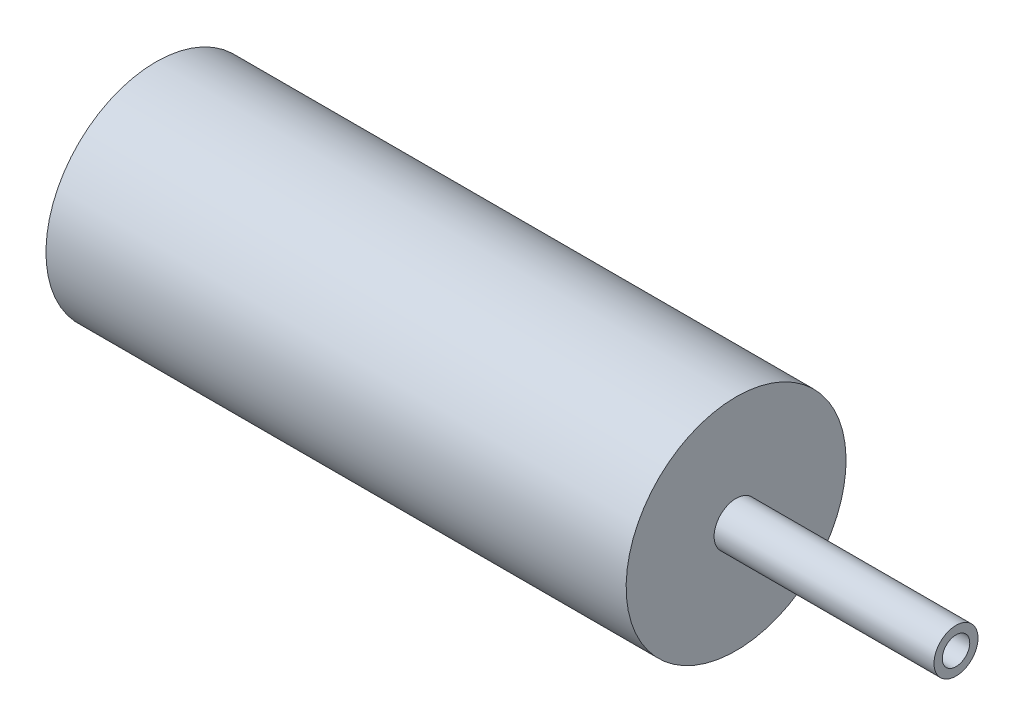
from build123d import *
from build123d.topology import SkipClean

# Parameters (mm, degrees)
CUT_EXTRUDE1_START  = -0.5
CUT_EXTRUDE1_DEPTH  = 2
CIRPATTERN1_COUNT   = 8
SKETCH3_R           = 0.75
SKETCH3_R_2         = 0.625
BOSS_EXTRUDE1_DEPTH = 2.5
CUT_EXTRUDE2_START  = -2.5
SKETCH4_R           = 0.625
CUT_EXTRUDE2_DEPTH  = 2.5
BOSS_EXTRUDE2_START = 10
SKETCH5_R           = 1
SKETCH5_R_2         = 0.625
BOSS_EXTRUDE2_DEPTH = 10


with BuildPart() as part:
    # Sketch1 → Revolve1 (revolve)
    with BuildSketch(Plane.XY):
        Polygon((0, 0), (0, 1), (-1, 2), (-7, 2), (-7, 4), (-10, 4), (-10, 3), (-13, 3), (-14.5, 4.5), (-24.88, 4.5), (-24.88, 5), (1.5, 5), (1.5, 0), align=None)
    revolve(axis=Axis((1.5, 0, 0), (-1, 0, 0)))

    # Sketch2 → Cut-Extrude1 (cut)
    with BuildSketch(Plane.ZY.offset(7).offset(CUT_EXTRUDE1_START)):
        with BuildLine():
            Line((-2, -0.1), (-3.9, -0.1))
            ThreePointArc((-3.9, -0.1), (-4, 0), (-3.9, 0.1))
            Line((-3.9, 0.1), (-2, 0.1))
            ThreePointArc((-2, 0.1), (-1.9, 0), (-2, -0.1))
        make_face()
    cut_extrude1 = extrude(amount=CUT_EXTRUDE1_DEPTH, mode=Mode.SUBTRACT)

    # CirPattern1: Cut-Extrude1 ×8 about axis
    cirpattern1_axis = Axis((0, 0, 0), (1, 0, 0))
    for i in range(1, CIRPATTERN1_COUNT):
        add(cut_extrude1.rotate(cirpattern1_axis, i * 360 / CIRPATTERN1_COUNT), mode=Mode.SUBTRACT)

    # Sketch3 → Boss-Extrude1 (add)
    with BuildSketch(Plane.ZY):
        with Locations(Location((0, 0, 0), (0, 0, 270))):
            Circle(SKETCH3_R)
        with Locations(Location((0, 0, 0), (0, 0, 270))):
            Circle(SKETCH3_R_2, mode=Mode.SUBTRACT)
    extrude(amount=BOSS_EXTRUDE1_DEPTH)

    # Sketch4 → Cut-Extrude2 (cut)
    with BuildSketch(Plane.ZY.offset(CUT_EXTRUDE2_START)):
        with Locations(Location((0, 0, 0), (0, 0, 90))):
            Circle(SKETCH4_R)
    extrude(amount=CUT_EXTRUDE2_DEPTH, mode=Mode.SUBTRACT)

    # Sketch5 → Boss-Extrude2 (add)
    with SkipClean():  # the faces are left unmerged after this step: merging them gives an invalid solid
        with BuildSketch(Plane(origin=(1.5, 0, 0), x_dir=(0, 0, -1), z_dir=(1, 0, 0)).offset(BOSS_EXTRUDE2_START)):
            with Locations(Location((0, 0, 0), (0, 0, 90))):
                Circle(SKETCH5_R)
            with Locations(Location((0, 0, 0), (0, 0, 90))):
                Circle(SKETCH5_R_2, mode=Mode.SUBTRACT)
        extrude(amount=-BOSS_EXTRUDE2_DEPTH)


solid = part.part
